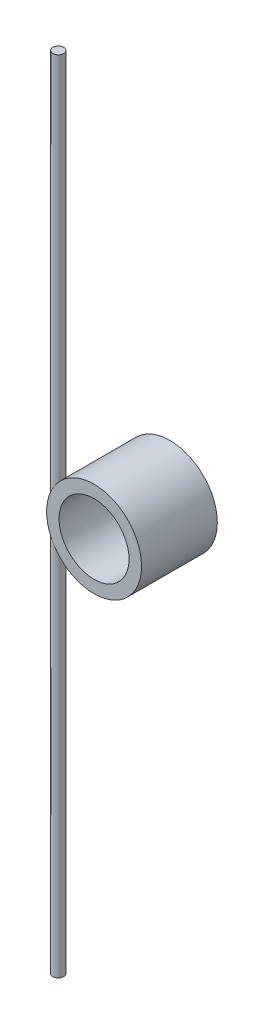
from build123d import *

# Parameters (mm, degrees)
SKETCH1_R           = 5.7
SKETCH1_R_2         = 4.2
BOSS_EXTRUDE1_DEPTH = 9.1
SKETCH2_R           = 0.65
BOSS_EXTRUDE2_DEPTH = 48


with BuildPart() as part:
    # Sketch1 → Boss-Extrude1 (new body)
    with BuildSketch(Plane.XY):
        Circle(SKETCH1_R)
        Circle(SKETCH1_R_2, mode=Mode.SUBTRACT)
    extrude(amount=BOSS_EXTRUDE1_DEPTH)

    # Sketch2 → Boss-Extrude2 (add, symmetric)
    with BuildSketch(Plane(origin=(0, 0, 0), x_dir=(1, 0, 0), z_dir=(0, 1, 0))):
        with Locations(Location((-4.94879538, -8.44469772, 0), (0, 0, 90))):
            Circle(SKETCH2_R)
    extrude(amount=BOSS_EXTRUDE2_DEPTH, both=True)


solid = part.part
